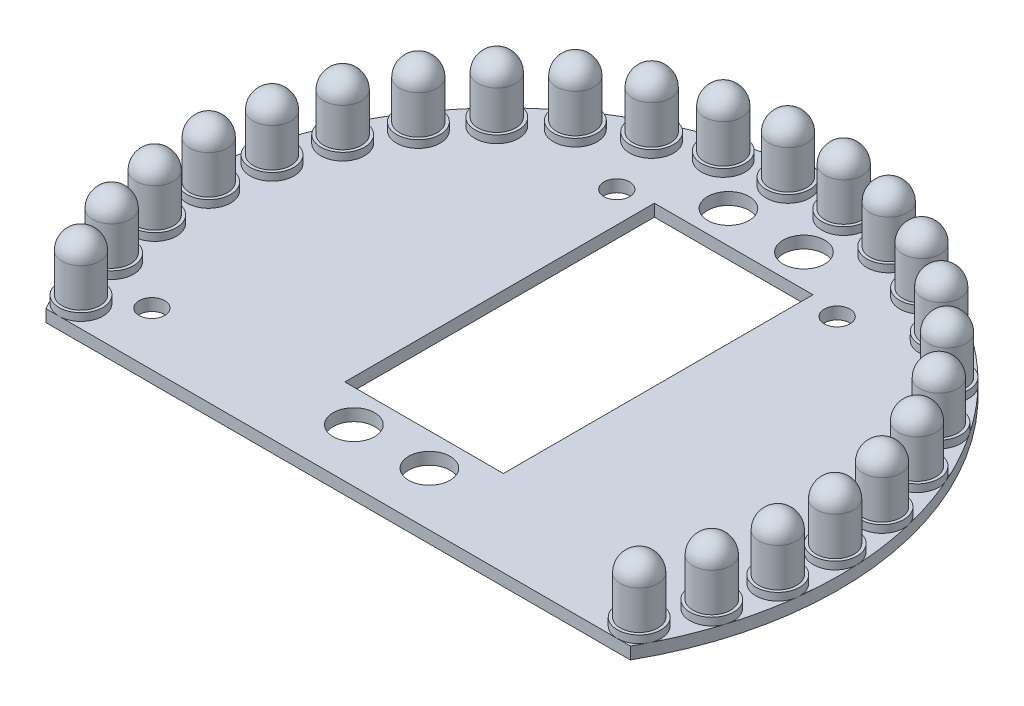
from build123d import *

# Parameters (mm, degrees)
SKETCH2_W           = 21
SKETCH2_H           = 41
BOSS_EXTRUDE1_DEPTH = 1.6
SKETCH3_R           = 2.9
BOSS_EXTRUDE3_DEPTH = 1
SKETCH4_R           = 2.5
BOSS_EXTRUDE4_DEPTH = 5.1
REVOLVE1_ANGLE      = 180
CIRPATTERN1_COUNT   = 24
CIRPATTERN1_ANGLE   = 234.36
SKETCH6_R           = 2.75
SKETCH6_R_2         = 1.7
CUT_EXTRUDE1_DEPTH  = 1.6


with BuildPart() as part:
    # Sketch2 → Boss-Extrude1 (new body)
    with BuildSketch(Plane(origin=(0, 0, 0), x_dir=(1, 0, 0), z_dir=(0, 1, 0))):
        with BuildLine():
            Line((-38.691130312, -21.881474704), (38.691130312, -21.881474704))
            ThreePointArc((38.691130312, -21.881474704), (0, 44.45), (-38.691130312, -21.881474704))
        make_face()
        with Locations((0, 10)):
            Rectangle(SKETCH2_W, SKETCH2_H, mode=Mode.SUBTRACT)
    extrude(amount=BOSS_EXTRUDE1_DEPTH)

    # Sketch3 → Boss-Extrude3 (add)
    with BuildSketch(Plane(origin=(0, 1.6, 0), x_dir=(1, 0, 0), z_dir=(0, 1, 0))):
        with Locations(Location((-36.960872799, -18.981474704, 0), (0, 0, 270))):
            Circle(SKETCH3_R)
    boss_extrude3 = extrude(amount=BOSS_EXTRUDE3_DEPTH)

    # Sketch4 → Boss-Extrude4 (add)
    with BuildSketch(Plane(origin=(0, 2.6, 0), x_dir=(1, 0, 0), z_dir=(0, 1, 0))):
        with Locations(Location((-36.960872799, -18.981474704, 0), (0, 0, 270))):
            Circle(SKETCH4_R)
    boss_extrude4 = extrude(amount=BOSS_EXTRUDE4_DEPTH)

    # Sketch5 → Revolve1 (revolve)
    with BuildSketch(Plane(origin=(0, 7.7, 0), x_dir=(1, 0, 0), z_dir=(0, 1, 0))):
        with BuildLine():
            Line((-39.460872799, -18.981474704), (-34.460872799, -18.981474704))
            ThreePointArc((-34.460872799, -18.981474704), (-36.960872799, -16.481474704), (-39.460872799, -18.981474704))
        make_face()
    revolve1 = revolve(axis=Axis((-39.460872799, 7.7, 18.981474704), (1, 0, 0)), revolution_arc=REVOLVE1_ANGLE)

    # CirPattern1: Boss-Extrude3, Boss-Extrude4, Revolve1 ×24 about axis
    cirpattern1_axis = Axis((0, 0, 0), (0, -1, 0))
    add([boss_extrude3.rotate(cirpattern1_axis, i * CIRPATTERN1_ANGLE / (CIRPATTERN1_COUNT - 1)) for i in range(1, CIRPATTERN1_COUNT)])
    add([boss_extrude4.rotate(cirpattern1_axis, i * CIRPATTERN1_ANGLE / (CIRPATTERN1_COUNT - 1)) for i in range(1, CIRPATTERN1_COUNT)])
    add([revolve1.rotate(cirpattern1_axis, i * CIRPATTERN1_ANGLE / (CIRPATTERN1_COUNT - 1)) for i in range(1, CIRPATTERN1_COUNT)])

    # Sketch6 → Cut-Extrude1 (cut)
    with BuildSketch(Plane(origin=(0, 1.6, 0), x_dir=(1, 0, 0), z_dir=(0, 1, 0))):
        with Locations(Location((4.99999, 34.80022, 0), (0, 0, 270))):
            Circle(SKETCH6_R)
        with Locations(Location((-4.99999, 34.80022, 0), (0, 0, 270))):
            Circle(SKETCH6_R)
        with Locations(Location((-31.75, -14.80022, 0), (0, 0, 270))):
            Circle(SKETCH6_R_2)
        with Locations(Location((4.99999, -14.80022, 0), (0, 0, 270))):
            Circle(SKETCH6_R)
        with Locations(Location((-4.99999, -14.80022, 0), (0, 0, 270))):
            Circle(SKETCH6_R)
        with Locations(Location((31.75, -14.80022, 0), (0, 0, 270))):
            Circle(SKETCH6_R_2)
        with Locations(Location((14.5894, 29.611, 0), (0, 0, 270))):
            Circle(SKETCH6_R_2)
        with Locations(Location((-14.5894, 29.611, 0), (0, 0, 270))):
            Circle(SKETCH6_R_2)
    extrude(amount=-CUT_EXTRUDE1_DEPTH, mode=Mode.SUBTRACT)


solid = part.part
